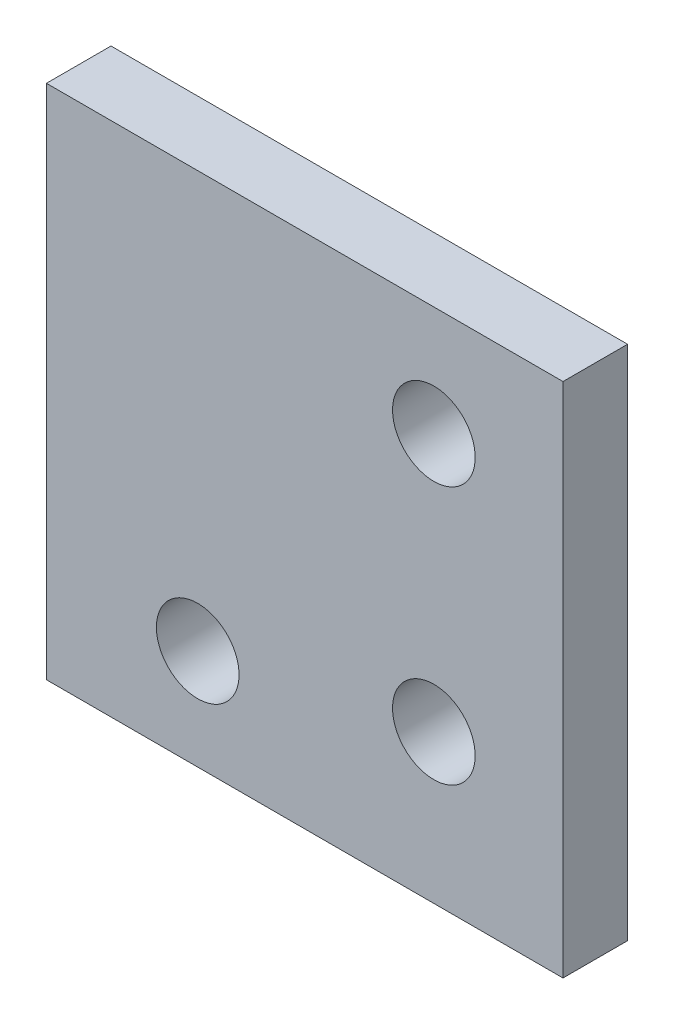
from build123d import *

# Parameters (mm, degrees)
SKETCH1_W               = 25.4
SKETCH1_H               = 25.4
BOSS_EXTRUDE1_DEPTH     = 3.175
CUT_EXTRUDE1_DEPTH      = 19.238986403
CUT_EXTRUDE1_DEPTH_BACK = 19.238986403
SKETCH2_R               = 2.032


with BuildPart() as part:
    # Sketch1 → Boss-Extrude1 (new body)
    with BuildSketch(Plane.XY):
        Rectangle(SKETCH1_W, SKETCH1_H)
    extrude(amount=BOSS_EXTRUDE1_DEPTH)

    # Sketch2 → Cut-Extrude1 (cut, two sides: drawn at the far end of the back side and taken through both)
    with BuildSketch(Plane(origin=(0, 0, 0), x_dir=(-1, 0, 0), z_dir=(0, 0, -1)).offset(-CUT_EXTRUDE1_DEPTH_BACK)):
        with Locations((5.260512242, -7.756353865)):
            Circle(SKETCH2_R)
        with Locations((-6.35, -5.396866107)):
            Circle(SKETCH2_R)
        with Locations((-6.35, 7.303133893)):
            Circle(SKETCH2_R)
    extrude(amount=CUT_EXTRUDE1_DEPTH + CUT_EXTRUDE1_DEPTH_BACK, mode=Mode.SUBTRACT)


solid = part.part
